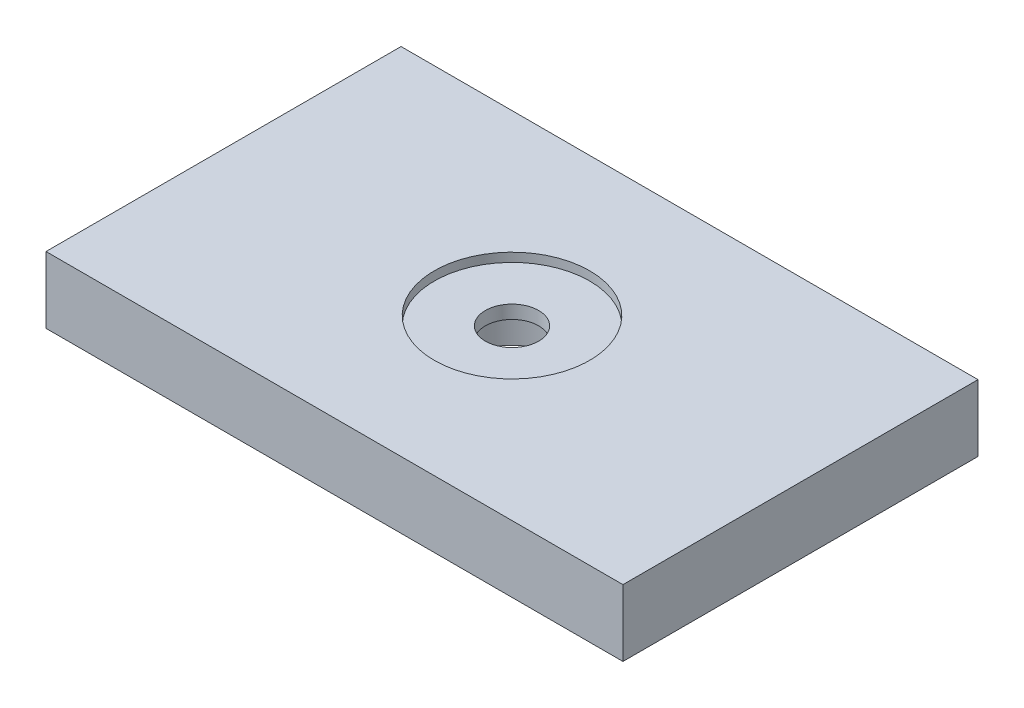
from build123d import *

# Parameters (mm, degrees)
SKETCH_4_W          = 130
SKETCH_4_H          = 80
EXTRUDE_3_DEPTH     = 15
SKETCH_5_R          = 17.5
CUT_EXTRUDE_1_DEPTH = 2
SKETCH_6_R          = 13
CUT_EXTRUDE_2_DEPTH = 10
SKETCH_7_R          = 6
CUT_EXTRUDE_3_DEPTH = 78.420927403


with BuildPart() as part:
    # Эскиз4 → Бобышка-Вытянуть3 (new body)
    with BuildSketch(Plane(origin=(0, 0, 0), x_dir=(1, 0, 0), z_dir=(0, 1, 0))):
        Rectangle(SKETCH_4_W, SKETCH_4_H)
    extrude(amount=EXTRUDE_3_DEPTH)

    # Эскиз5 → Вырез-Вытянуть1 (cut)
    with BuildSketch(Plane(origin=(0, 15, 0), x_dir=(1, 0, 0), z_dir=(0, 1, 0))):
        with Locations(Location((0, 0, 0), (0, 0, 270))):
            Circle(SKETCH_5_R)
    extrude(amount=-CUT_EXTRUDE_1_DEPTH, mode=Mode.SUBTRACT)

    # Эскиз6 → Вырез-Вытянуть2 (cut)
    with BuildSketch(Plane.XZ):
        with Locations(Location((0, 0, 0), (0, 0, 270))):
            Circle(SKETCH_6_R)
    extrude(amount=-CUT_EXTRUDE_2_DEPTH, mode=Mode.SUBTRACT)

    # Эскиз7 → Вырез-Вытянуть3 (cut, through all)
    with BuildSketch(Plane(origin=(0, 13, 0), x_dir=(1, 0, 0), z_dir=(0, 1, 0))):
        with Locations(Location((0, 0, 0), (0, 0, 270))):
            Circle(SKETCH_7_R)
    extrude(amount=-CUT_EXTRUDE_3_DEPTH, mode=Mode.SUBTRACT)


solid = part.part
